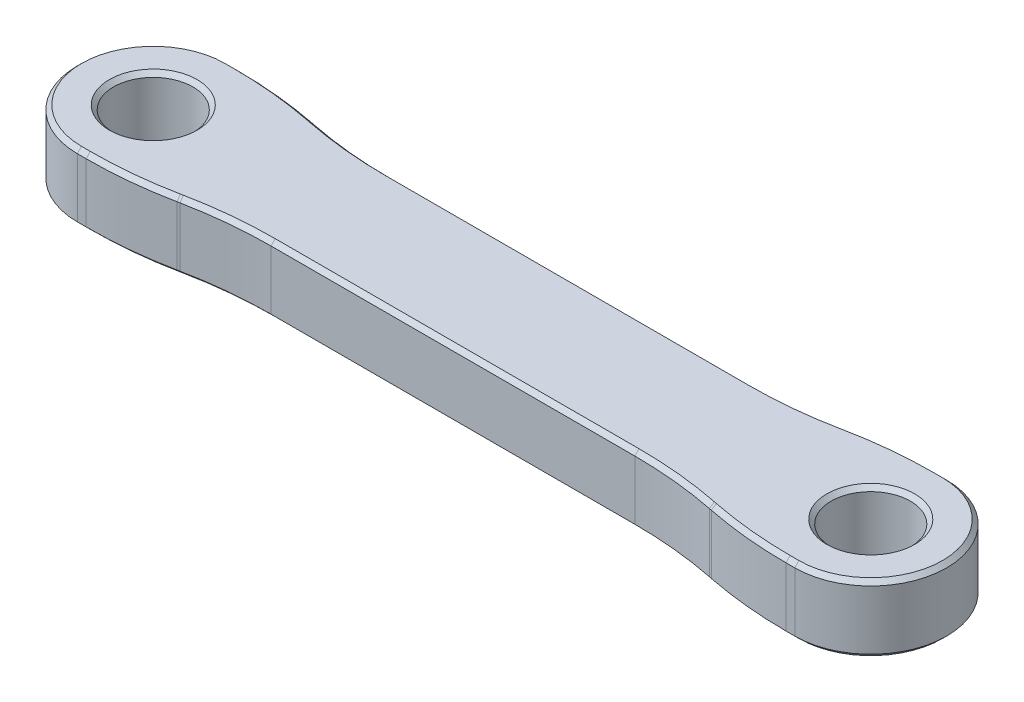
from build123d import *

# Parameters (mm, degrees)
SKETCH1_R           = 4.7
BOSS_EXTRUDE1_DEPTH = 8
FILLET1_R           = 50
FILLET2_R           = 50
CHAMFER1_SIZE       = 0.5
CHAMFER2_SIZE       = 0.5


with BuildPart() as part:
    # Sketch1 → Boss-Extrude1 (new body)
    with BuildSketch(Plane(origin=(0, 0, 0), x_dir=(1, 0, 0), z_dir=(0, 1, 0))):
        with BuildLine():
            Line((6, 9), (16, 7))
            Line((16, 7), (69, 7))
            Line((69, 7), (79, 9))
            Line((79, 9), (85, 9))
            ThreePointArc((85, 9), (94, 0), (85, -9))
            Line((85, -9), (79, -9))
            Line((79, -9), (69, -7))
            Line((69, -7), (16, -7))
            Line((16, -7), (6, -9))
            Line((6, -9), (0, -9))
            ThreePointArc((0, -9), (-9, 0), (0, 9))
            Line((0, 9), (6, 9))
        make_face()
        with Locations(Location((0, 0, 0), (0, 0, 270))):
            Circle(SKETCH1_R, mode=Mode.SUBTRACT)
        with Locations(Location((85, 0, 0), (0, 0, 270))):
            Circle(SKETCH1_R, mode=Mode.SUBTRACT)
    extrude(amount=BOSS_EXTRUDE1_DEPTH)

    # Fillet1
    fillet1_edges = [part.edges().sort_by_distance(p)[0] for p in [
        (16, 4, -7),
        (69, 4, -7),
        (69, 4, 7),
        (16, 4, 7),
    ]]
    fillet(fillet1_edges, radius=FILLET1_R)

    # Fillet2
    fillet2_edges = [part.edges().sort_by_distance(p)[0] for p in [
        (6, 4, 9),
        (6, 4, -9),
        (79, 4, -9),
        (79, 4, 9),
    ]]
    fillet(fillet2_edges, radius=FILLET2_R)

    # Chamfer1
    chamfer1_edges = [part.edges().sort_by_distance(p)[0] for p in [
        (0, 0, -4.7),
        (0, 8, -4.7),
        (85, 0, -4.7),
        (85, 8, -4.7),
    ]]
    chamfer(chamfer1_edges, length=CHAMFER1_SIZE)

    # Chamfer2
    chamfer2_edges = [part.edges().sort_by_distance(p)[0] for p in [
        (0.52451216, 0, 9),
        (-9, 0, 0),
        (84.47548784, 0, -9),
        (94, 0, 0),
        (94, 8, 0),
        (84.47548784, 8, -9),
        (74, 0, 8),
        (-9, 8, 0),
        (74, 8, 8),
        (42.5, 0, 7),
        (42.5, 8, 7),
        (0.52451216, 8, 9),
        (42.5, 0, -7),
        (42.5, 8, -7),
        (11, 0, -8),
        (11, 8, -8),
        (68.975905219, 0, 7.243333667),
        (68.975905219, 8, 7.243333667),
        (16.024094781, 0, 7.243333667),
        (16.024094781, 8, 7.243333667),
        (68.975905219, 0, -7.243333667),
        (68.975905219, 8, -7.243333667),
        (16.024094781, 0, -7.243333667),
        (16.024094781, 8, -7.243333667),
        (74, 0, -8),
        (74, 8, -8),
        (11, 0, 8),
        (0.52451216, 0, -9),
        (84.47548784, 0, 9),
        (5.975905219, 0, 8.756666333),
        (79.024094781, 0, 8.756666333),
        (5.975905219, 0, -8.756666333),
        (79.024094781, 0, -8.756666333),
        (11, 8, 8),
        (84.47548784, 8, 9),
        (0.52451216, 8, -9),
        (5.975905219, 8, 8.756666333),
        (79.024094781, 8, 8.756666333),
        (5.975905219, 8, -8.756666333),
        (79.024094781, 8, -8.756666333),
    ]]
    chamfer(chamfer2_edges, length=CHAMFER2_SIZE)


solid = part.part
